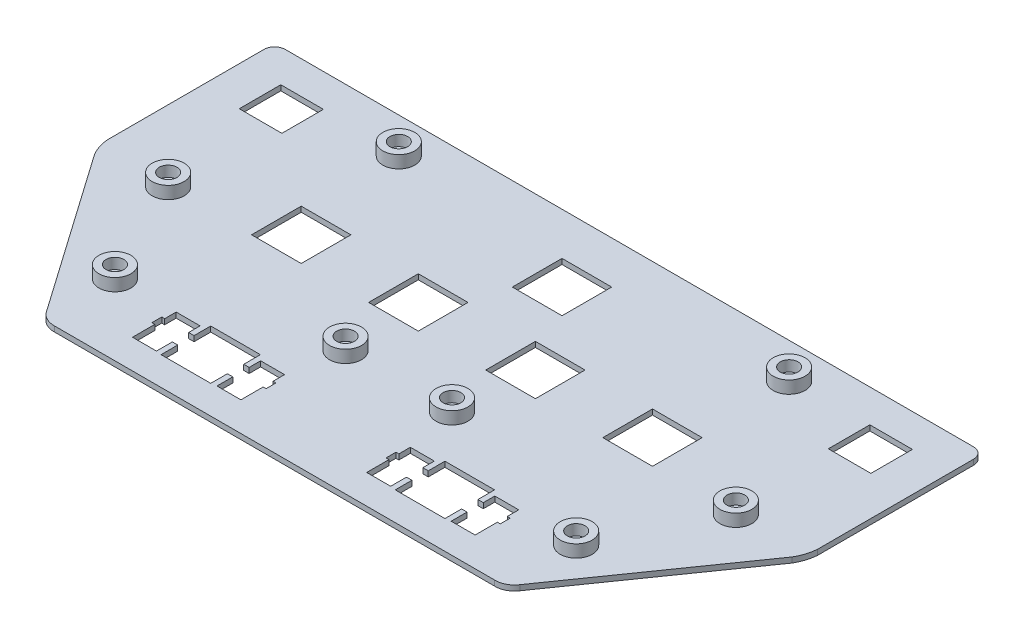
from build123d import *

# Parameters (mm, degrees)
SKETCH_1_W      = 14
SKETCH_1_H      = 14
SKETCH_1_W_2    = 12
SKETCH_1_H_2    = 11.7
EXTRUDE_1_DEPTH = 1.5
SKETCH_2_R      = 4.5
SKETCH_2_R_2    = 2.5
EXTRUDE_2_DEPTH = 5
SKETCH_3_R      = 2.5
EXTRUDE_3_DEPTH = 2


with BuildPart() as part:
    # 草图1 → 凸台-拉伸1 (new body)
    with BuildSketch(Plane(origin=(0, 0, 0), x_dir=(1, 0, 0), z_dir=(0, 1, 0))):
        with BuildLine():
            Line((197, 0), (3, 0))
            ThreePointArc((3, 0), (0.878679656, -0.878679656), (0, -3))
            Line((0, -3), (0, -47))
            ThreePointArc((0, -47), (0.538734236, -49.830178992), (1.720387033, -52.457695762))
            Line((1.720387033, -52.457695762), (33.279612967, -97.542304238))
            ThreePointArc((33.279612967, -97.542304238), (35.317699373, -99.389808931), (38, -100))
            Line((38, -100), (162, -100))
            ThreePointArc((162, -100), (164.682300627, -99.389808931), (166.720387033, -97.542304238))
            Line((166.720387033, -97.542304238), (198.279612967, -52.457695762))
            ThreePointArc((198.279612967, -52.457695762), (199.461265764, -49.830178992), (200, -47))
            Line((200, -47), (200, -3))
            ThreePointArc((200, -3), (199.121320344, -0.878679656), (197, 0))
        make_face()
        with Locations((100, -19)):
            Rectangle(SKETCH_1_W, SKETCH_1_H, mode=Mode.SUBTRACT)
        with Locations((83.5, -43)):
            Rectangle(SKETCH_1_W, SKETCH_1_H, mode=Mode.SUBTRACT)
        with Locations((116.5, -43)):
            Rectangle(SKETCH_1_W, SKETCH_1_H, mode=Mode.SUBTRACT)
        with Locations((50.5, -43)):
            Rectangle(SKETCH_1_W, SKETCH_1_H, mode=Mode.SUBTRACT)
        with Locations((149.5, -43)):
            Rectangle(SKETCH_1_W, SKETCH_1_H, mode=Mode.SUBTRACT)
        Polygon((60, -78), (74, -78), (74, -82.7), (75.525, -82.7), (75.525, -79.47), (82.275, -79.47), (82.275, -82.7), (83.1, -82.7), (83.1, -85.5), (82.275, -85.5), (82.275, -91.77), (75.525, -91.77), (75.525, -87.3), (74, -87.3), (74, -92), (60, -92), (60, -87.3), (58.475, -87.3), (58.475, -91.77), (51.725, -91.77), (51.725, -85.5), (50.9, -85.5), (50.9, -82.7), (51.725, -82.7), (51.725, -79.47), (58.475, -79.47), (58.475, -82.7), (60, -82.7), align=None, mode=Mode.SUBTRACT)
        Polygon((140, -78), (126, -78), (126, -82.7), (124.475, -82.7), (124.475, -79.47), (117.725, -79.47), (117.725, -82.7), (116.9, -82.7), (116.9, -85.5), (117.725, -85.5), (117.725, -91.77), (124.475, -91.77), (124.475, -87.3), (126, -87.3), (126, -92), (140, -92), (140, -87.3), (141.525, -87.3), (141.525, -91.77), (148.275, -91.77), (148.275, -85.5), (149.1, -85.5), (149.1, -82.7), (148.275, -82.7), (148.275, -79.47), (141.525, -79.47), (141.525, -82.7), (140, -82.7), align=None, mode=Mode.SUBTRACT)
        with Locations((17, -15.1)):
            Rectangle(SKETCH_1_W_2, SKETCH_1_H_2, mode=Mode.SUBTRACT)
        with Locations((183, -15.1)):
            Rectangle(SKETCH_1_W_2, SKETCH_1_H_2, mode=Mode.SUBTRACT)
    extrude(amount=EXTRUDE_1_DEPTH)

    # 草图2 → 凸台-拉伸2 (add)
    # profile 1 of 8: a face of its own
    with BuildSketch(Plane(origin=(0, 0, 0), x_dir=(1, 0, 0), z_dir=(0, 1, 0))):
        with Locations(Location((35, -80, 0), (0, 0, 90))):
            Circle(SKETCH_2_R)
        with Locations(Location((35, -80, 0), (0, 0, 90))):
            Circle(SKETCH_2_R_2, mode=Mode.SUBTRACT)
    # profile 2 of 8: a face of its own
    with BuildSketch(Plane(origin=(0, 0, 0), x_dir=(1, 0, 0), z_dir=(0, 1, 0))):
        with Locations(Location((20, -50, 0), (0, 0, 90))):
            Circle(SKETCH_2_R)
        with Locations(Location((20, -50, 0), (0, 0, 90))):
            Circle(SKETCH_2_R_2, mode=Mode.SUBTRACT)
    # profile 3 of 8: a face of its own
    with BuildSketch(Plane(origin=(0, 0, 0), x_dir=(1, 0, 0), z_dir=(0, 1, 0))):
        with Locations(Location((45, -10, 0), (0, 0, 90))):
            Circle(SKETCH_2_R)
        with Locations(Location((45, -10, 0), (0, 0, 90))):
            Circle(SKETCH_2_R_2, mode=Mode.SUBTRACT)
    # profile 4 of 8: a face of its own
    with BuildSketch(Plane(origin=(0, 0, 0), x_dir=(1, 0, 0), z_dir=(0, 1, 0))):
        with Locations(Location((85, -65, 0), (0, 0, 90))):
            Circle(SKETCH_2_R)
        with Locations(Location((85, -65, 0), (0, 0, 90))):
            Circle(SKETCH_2_R_2, mode=Mode.SUBTRACT)
    # profile 5 of 8: a face of its own
    with BuildSketch(Plane(origin=(0, 0, 0), x_dir=(1, 0, 0), z_dir=(0, 1, 0))):
        with Locations(Location((115, -65, 0), (0, 0, 90))):
            Circle(SKETCH_2_R)
        with Locations(Location((115, -65, 0), (0, 0, 90))):
            Circle(SKETCH_2_R_2, mode=Mode.SUBTRACT)
    # profile 6 of 8: a face of its own
    with BuildSketch(Plane(origin=(0, 0, 0), x_dir=(1, 0, 0), z_dir=(0, 1, 0))):
        with Locations(Location((165, -80, 0), (0, 0, 90))):
            Circle(SKETCH_2_R)
        with Locations(Location((165, -80, 0), (0, 0, 90))):
            Circle(SKETCH_2_R_2, mode=Mode.SUBTRACT)
    # profile 7 of 8: a face of its own
    with BuildSketch(Plane(origin=(0, 0, 0), x_dir=(1, 0, 0), z_dir=(0, 1, 0))):
        with Locations(Location((155, -10, 0), (0, 0, 90))):
            Circle(SKETCH_2_R)
        with Locations(Location((155, -10, 0), (0, 0, 90))):
            Circle(SKETCH_2_R_2, mode=Mode.SUBTRACT)
    # profile 8 of 8: a face of its own
    with BuildSketch(Plane(origin=(0, 0, 0), x_dir=(1, 0, 0), z_dir=(0, 1, 0))):
        with Locations(Location((180, -50, 0), (0, 0, 90))):
            Circle(SKETCH_2_R)
        with Locations(Location((180, -50, 0), (0, 0, 90))):
            Circle(SKETCH_2_R_2, mode=Mode.SUBTRACT)
    extrude(amount=EXTRUDE_2_DEPTH)

    # 草图3 → 凸台-拉伸3 (add)
    with BuildSketch(Plane(origin=(0, 0, 0), x_dir=(1, 0, 0), z_dir=(0, 1, 0))):
        with Locations(Location((180, -50, 0), (0, 0, 270))):
            Circle(SKETCH_3_R)
        with Locations(Location((165, -80, 0), (0, 0, 270))):
            Circle(SKETCH_3_R)
        with Locations(Location((115, -65, 0), (0, 0, 270))):
            Circle(SKETCH_3_R)
        with Locations(Location((155, -10, 0), (0, 0, 270))):
            Circle(SKETCH_3_R)
        with Locations(Location((45, -10, 0), (0, 0, 270))):
            Circle(SKETCH_3_R)
        with Locations(Location((20, -50, 0), (0, 0, 270))):
            Circle(SKETCH_3_R)
        with Locations(Location((35, -80, 0), (0, 0, 270))):
            Circle(SKETCH_3_R)
        with Locations(Location((85, -65, 0), (0, 0, 270))):
            Circle(SKETCH_3_R)
    extrude(amount=EXTRUDE_3_DEPTH)


solid = part.part
